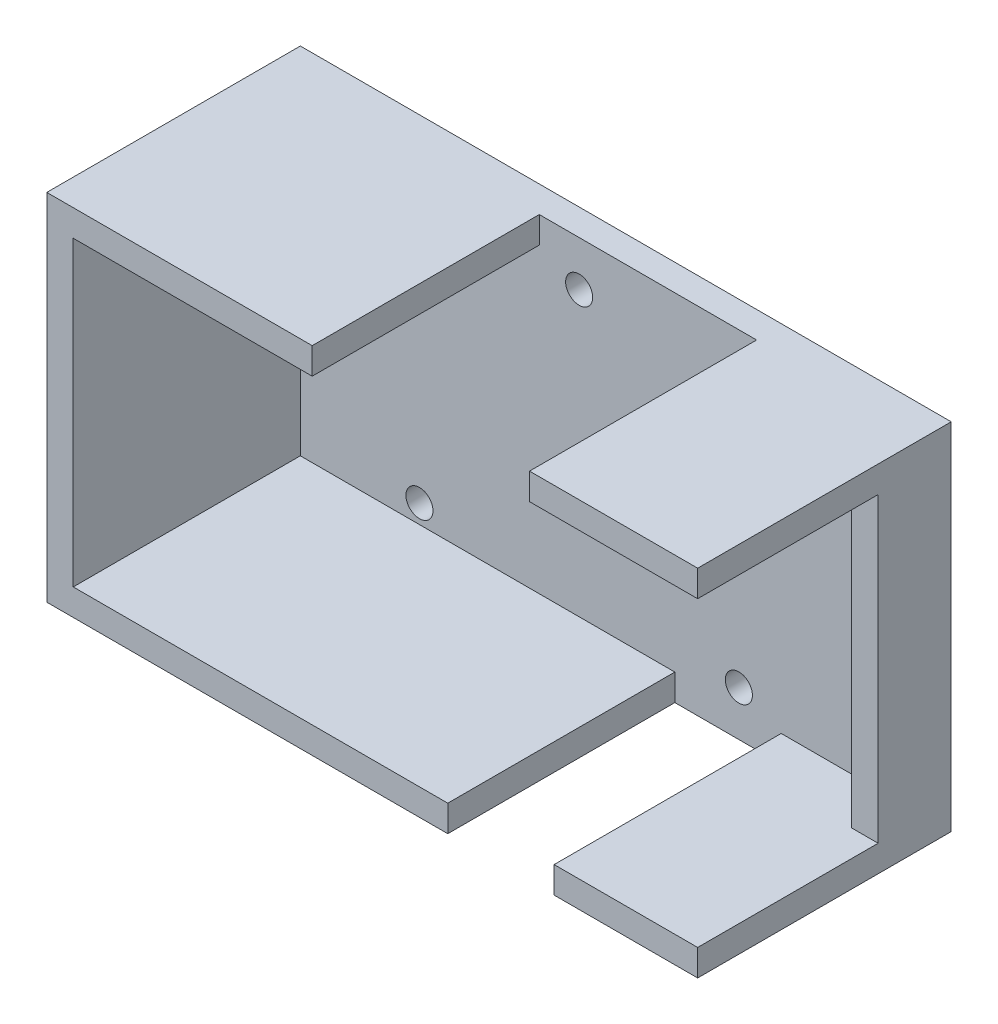
from build123d import *

# Parameters (mm, degrees)
SKETCH1_W           = 54.9656
SKETCH1_H           = 29.972
BOSS_EXTRUDE1_DEPTH = 21.4122
SHELL1_T            = -2.2352
SKETCH2_R           = 1.143
CUT_EXTRUDE1_DEPTH  = 38.925806526
SKETCH3_W           = 2.2352
SKETCH3_H           = 25.5016
CUT_EXTRUDE2_DEPTH  = 15.24
SKETCH4_W           = 8.981533828
SKETCH4_H           = 2.2352
SKETCH4_W_2         = 18.352338923
CUT_EXTRUDE3_DEPTH  = 19.177
SKETCH6_W           = 0.635
SKETCH6_H           = 1.8288
BOSS_EXTRUDE2_DEPTH = 5.08


with BuildPart() as part:
    # Sketch1 → Boss-Extrude1 (new body)
    with BuildSketch(Plane.XY):
        Rectangle(SKETCH1_W, SKETCH1_H)
    extrude(amount=BOSS_EXTRUDE1_DEPTH)

    # Shell1
    shell1_openings = [part.faces().sort_by_distance(p)[0] for p in [
        (0, 0, 21.4122),
    ]]
    offset(amount=SHELL1_T, openings=shell1_openings, kind=Kind.INTERSECTION)

    # Sketch2 → Cut-Extrude1 (cut, through all)
    with BuildSketch(Plane(origin=(0, 0, 0), x_dir=(-1, 0, 0), z_dir=(0, 0, -1))):
        with Locations((1.7018, 11.176)):
            Circle(SKETCH2_R)
        with Locations((-11.7856, -11.176)):
            Circle(SKETCH2_R)
        with Locations((15.1892, -11.176)):
            Circle(SKETCH2_R)
    extrude(amount=-CUT_EXTRUDE1_DEPTH, mode=Mode.SUBTRACT)

    # Sketch3 → Cut-Extrude2 (cut)
    with BuildSketch(Plane.XY.offset(21.4122)):
        with Locations((26.3652, 0)):
            Rectangle(SKETCH3_W, SKETCH3_H)
    extrude(amount=-CUT_EXTRUDE2_DEPTH, mode=Mode.SUBTRACT)

    # Sketch4 → Cut-Extrude3 (cut)
    with BuildSketch(Plane.XY.offset(21.4122)):
        with Locations((10.870255505, -13.8684)):
            Rectangle(SKETCH4_W, SKETCH4_H)
        with Locations((4.107846369, 13.8684)):
            Rectangle(SKETCH4_W_2, SKETCH4_H)
    extrude(amount=-CUT_EXTRUDE3_DEPTH, mode=Mode.SUBTRACT)

    # Sketch6 → Boss-Extrude2 (add)
    with BuildSketch(Plane.ZY.offset(27.4828)):
        with Locations((0.3175, 6.4516)):
            Rectangle(SKETCH6_W, SKETCH6_H)
        with Locations((0.3175, -6.2992)):
            Rectangle(SKETCH6_W, SKETCH6_H)
    extrude(amount=BOSS_EXTRUDE2_DEPTH)


solid = part.part
